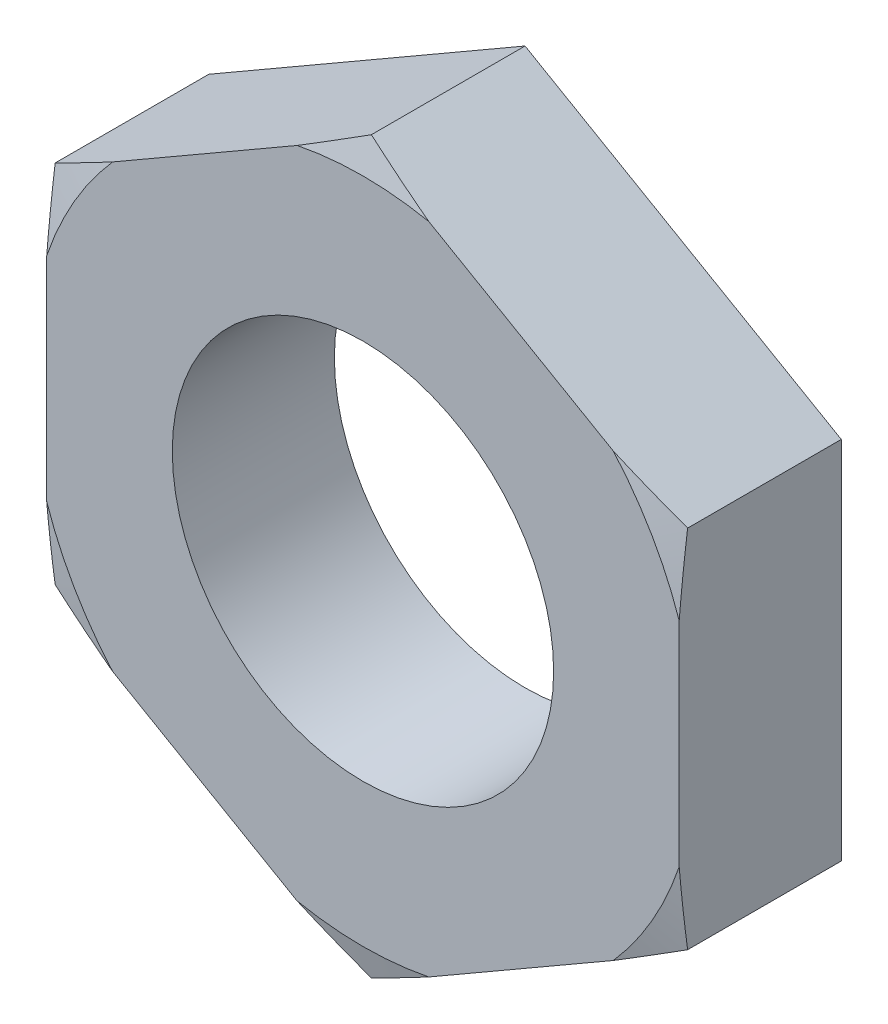
from build123d import *

# Parameters (mm, degrees)
SKETCH_1_R          = 2
EXTRUDE_542_DEPTH   = 1.7
SKETCH_2_OUTSIDE_W  = 58.042
SKETCH_2_OUTSIDE_H  = 59.068
SKETCH_2_OUTSIDE_R  = 3.5
CUT_EXTRUDE_1_DEPTH = 6.344209483
CUT_EXTRUDE_1_DRAFT = -75


with BuildPart() as part:
    # 草图1 → Extrude 542 (new body)
    with BuildSketch(Plane.XY):
        Polygon((0, 3.83), (-3.316877296, 1.915), (-3.316877296, -1.915), (0, -3.83), (3.316877296, -1.915), (3.316877296, 1.915), align=None)
        Circle(SKETCH_1_R, mode=Mode.SUBTRACT)
    extrude(amount=EXTRUDE_542_DEPTH)


with BuildPart() as cut_extrude_1_tool:
    # 草图2 outside → 切除-拉伸1 (with draft: the straight prism first)
    with BuildSketch(Plane.XY.offset(1.7)):
        Rectangle(SKETCH_2_OUTSIDE_W, SKETCH_2_OUTSIDE_H)
        Circle(SKETCH_2_OUTSIDE_R, mode=Mode.SUBTRACT)
    extrude(amount=-CUT_EXTRUDE_1_DEPTH)
    # 切除-拉伸1: the draft: its side faces are tilted about the plane it starts from
    cut_extrude_1_sides = [cut_extrude_1_tool.faces().sort_by_distance(p)[0] for p in [
        (0, -29.534, -1.472104742),
        (29.021, 0, -1.472104742),
        (0, 29.534, -1.472104742),
        (-29.021, 0, -1.472104742),
        (-3.5, 0, -1.472104742),
    ]]
    draft(cut_extrude_1_sides, Plane.XY.offset(1.7), CUT_EXTRUDE_1_DRAFT)


with BuildPart() as part_1:
    add(part.part)

    # 切除-拉伸1: cut by cut_extrude_1_tool
    add(cut_extrude_1_tool.part, mode=Mode.SUBTRACT)


solid = part_1.part
